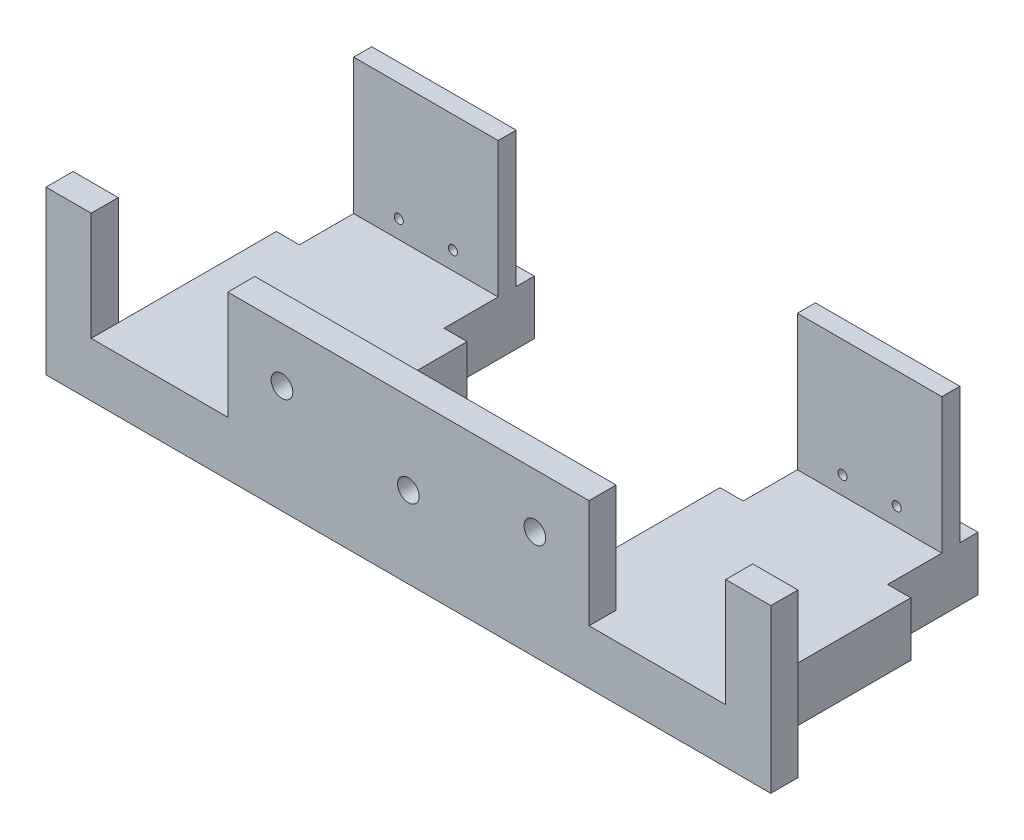
from build123d import *

# Parameters (mm, degrees)
SKETCH_1_W               = 159.79179057
SKETCH_1_H               = 74.251758256
EXTRUDE_1_DEPTH          = 20
EXTRUDE_2_DEPTH          = 20
EXTRUDE_3_DEPTH          = 10
CUT_EXTRUDE_1_DEPTH      = 531.606136663
CUT_EXTRUDE_1_DEPTH_BACK = 531.606136663
SKETCH_3_R               = 12
EXTRUDE_4_DEPTH          = 350
SKETCH_5_W               = 211.25
SKETCH_5_H               = 65
EXTRUDE_5_DEPTH          = 60
CUT_EXTRUDE_2_DEPTH      = 876.769934526
CUT_EXTRUDE_2_DEPTH_BACK = 876.769934526
SKETCH_6_W               = 160
SKETCH_6_H               = 30
SKETCH_7_R               = 25
EXTRUDE_6_DEPTH          = 185
CUT_EXTRUDE_3_DEPTH      = 676.870656298
CUT_EXTRUDE_3_DEPTH_BACK = 676.870656298
SKETCH_8_W               = 25.625
SKETCH_8_H               = 240
SKETCH_11_R              = 40
EXTRUDE_8_DEPTH          = 93.091049
EXTRUDE_9_DEPTH          = 30
EXTRUDE_10_DEPTH         = 93.091048505
EXTRUDE_11_DEPTH         = 155
SKETCH_13_W              = 644.241004896
SKETCH_13_H              = 193.771713101
CUT_EXTRUDE_5_DEPTH      = 229
CHAMFER_6_SIZE           = 40
SKETCH_15_W              = 224.735234266
SKETCH_15_H              = 137.83761035
SKETCH_15_W_2            = 260.692871749
SKETCH_15_H_2            = 187.77877352
CUT_EXTRUDE_8_DEPTH      = 406
SKETCH_16_W              = 1192.594976507
SKETCH_16_H              = 256.002705907
CUT_EXTRUDE_9_DEPTH      = 406
SKETCH_18_W              = 160
SKETCH_18_H              = 20
EXTRUDE_12_DEPTH         = 150
SKETCH_19_W              = 160
SKETCH_19_H              = 60
EXTRUDE_13_DEPTH         = 20
SKETCH_20_R              = 5
CUT_EXTRUDE_10_DEPTH     = 65


with BuildPart() as part:
    # 草图1 → 凸台-拉伸1 (new body)
    with BuildSketch(Plane.XY):
        with Locations((10.911998257, 1.128827406)):
            Rectangle(SKETCH_1_W, SKETCH_1_H)
    extrude(amount=EXTRUDE_1_DEPTH)

    # 草图2 → 凸台-拉伸2 (add)
    with BuildSketch(Plane(origin=(0, 0, 0), x_dir=(-1, 0, 0), z_dir=(0, 0, -1))):
        Polygon((309.192106458, 38.254706534), (-90.807893542, 38.254706534), (-90.807893542, -81.745293466), (-242.057893542, -81.745293466), (-242.057893542, 38.254706534), (-292.057893542, 38.254706534), (-292.057893542, -141.745293466), (510.442106458, -141.745293466), (510.442106458, 38.254706534), (460.442106458, 38.254706534), (460.442106458, -81.745293466), (309.192106458, -81.745293466), align=None)
    extrude(amount=-EXTRUDE_2_DEPTH)

    # 草图2<2> → 凸台-拉伸3 (add)
    with BuildSketch(Plane(origin=(0, 0, 0), x_dir=(-1, 0, 0), z_dir=(0, 0, -1))):
        Polygon((309.192106458, 38.254706534), (-90.807893542, 38.254706534), (-90.807893542, -81.745293466), (-242.057893542, -81.745293466), (-242.057893542, 38.254706534), (-292.057893542, 38.254706534), (-292.057893542, -141.745293466), (510.442106458, -141.745293466), (510.442106458, 38.254706534), (460.442106458, 38.254706534), (460.442106458, -81.745293466), (309.192106458, -81.745293466), align=None)
    extrude(amount=EXTRUDE_3_DEPTH)

    # 草图3 → 切除-拉伸1 (cut, two sides: drawn at the far end of the back side and taken through both)
    with BuildSketch(Plane(origin=(0, 0, -10), x_dir=(-1, 0, 0), z_dir=(0, 0, -1)).offset(-CUT_EXTRUDE_1_DEPTH_BACK)):
        with Locations((-30.807893542, -21.745293466)):
            Circle(SKETCH_3_R)
        with Locations((109.192106458, -51.745293466)):
            Circle(SKETCH_3_R)
        with Locations((249.192106458, -21.745293466)):
            Circle(SKETCH_3_R)
    extrude(amount=CUT_EXTRUDE_1_DEPTH + CUT_EXTRUDE_1_DEPTH_BACK, mode=Mode.SUBTRACT)

    # 草图4 → 凸台-拉伸4 (add)
    with BuildSketch(Plane(origin=(0, 0, -10), x_dir=(-1, 0, 0), z_dir=(0, 0, -1))):
        Polygon((460.442106458, -81.745293466), (309.192106458, -81.745293466), (249.192106458, -81.745293466), (249.192106458, -141.745293466), (309.192106458, -141.745293466), (460.442106458, -141.745293466), align=None)
        Polygon((-242.057893542, -81.745293466), (-90.807893542, -81.745293466), (-30.807893542, -81.745293466), (-30.807893542, -141.745293466), (-90.807893542, -141.745293466), (-242.057893542, -141.745293466), align=None)
    extrude(amount=EXTRUDE_4_DEPTH)

    # 草图5 → 凸台-拉伸5 (add)
    with BuildSketch(Plane.XZ.offset(141.745293466)):
        with Locations((136.432893542, -392.5)):
            Rectangle(SKETCH_5_W, SKETCH_5_H)
        with Locations((-354.817106458, -392.5)):
            Rectangle(SKETCH_5_W, SKETCH_5_H)
    extrude(amount=-EXTRUDE_5_DEPTH)

    # 草图6 → 切除-拉伸2 (cut, two sides: drawn at the far end of the back side and taken through both)
    with BuildSketch(Plane(origin=(242.057893542, 0, 0), x_dir=(0, 0, -1), z_dir=(1, 0, 0)).offset(-CUT_EXTRUDE_2_DEPTH_BACK)):
        with Locations((345, -96.745293466)):
            Rectangle(SKETCH_6_W, SKETCH_6_H)
    extrude(amount=CUT_EXTRUDE_2_DEPTH + CUT_EXTRUDE_2_DEPTH_BACK, mode=Mode.SUBTRACT)

    # 草图7 → 凸台-拉伸6 (add)
    with BuildSketch(Plane.XZ.offset(141.745293466)):
        with Locations((-354.817106458, -345)):
            Circle(SKETCH_7_R)
        with Locations((136.432893542, -345)):
            Circle(SKETCH_7_R)
    extrude(amount=-EXTRUDE_6_DEPTH)

    # 草图8 → 切除-拉伸3 (cut, two sides: drawn at the far end of the back side and taken through both)
    with BuildSketch(Plane(origin=(0, -81.745293466, 0), x_dir=(1, 0, 0), z_dir=(0, 1, 0)).offset(-CUT_EXTRUDE_3_DEPTH_BACK)):
        with Locations((43.620393542, 305)):
            Rectangle(SKETCH_8_W, SKETCH_8_H)
        Polygon((-434.817106458, 425), (-434.817106458, 265), (-434.817106458, 185), (-460.442106458, 185), (-460.442106458, 516.096231242), (-434.817106458, 516.096231242), align=None)
        Polygon((-274.817106458, 425), (-274.817106458, 265), (-274.817106458, 185), (-219.643944132, 185), (-219.643944132, 516.096231242), (-274.817106458, 516.096231242), align=None)
        with Locations((229.245393542, 305)):
            Rectangle(SKETCH_8_W, SKETCH_8_H)
    extrude(amount=CUT_EXTRUDE_3_DEPTH + CUT_EXTRUDE_3_DEPTH_BACK, mode=Mode.SUBTRACT)

    # 草图11 → 凸台-拉伸8 (add)
    with BuildSketch(Plane(origin=(0, -111.745293466, 0), x_dir=(1, 0, 0), z_dir=(0, 1, 0))):
        with Locations(Location((-354.817106458, 345, 0), (0, 0, 90))):
            Circle(SKETCH_11_R)
        with Locations(Location((136.432893542, 345, 0), (0, 0, 90))):
            Circle(SKETCH_11_R)
    extrude(amount=EXTRUDE_8_DEPTH)

    # 草图12 → 凸台-拉伸9 (add)
    with BuildSketch(Plane(origin=(0, -111.745293466, 0), x_dir=(1, 0, 0), z_dir=(0, 1, 0))):
        with BuildLine():
            ThreePointArc((-569.817106458, 345), (-529.817106458, 385), (-489.817106458, 345))
            Line((-489.817106458, 345), (-434.817106458, 345))
            Line((-434.817106458, 345), (-434.817106458, 425))
            Line((-434.817106458, 425), (-569.817106458, 425))
            Line((-569.817106458, 425), (-609.817106458, 385))
            Line((-609.817106458, 385), (-609.817106458, 345))
            Line((-609.817106458, 345), (-569.817106458, 345))
        make_face()
        with BuildLine():
            ThreePointArc((-569.817106458, 345), (-529.817106458, 305), (-489.817106458, 345))
            Line((-489.817106458, 345), (-504.817106458, 345))
            ThreePointArc((-504.817106458, 345), (-529.817106458, 320), (-554.817106458, 345))
            Line((-554.817106458, 345), (-569.817106458, 345))
        make_face()
        with BuildLine():
            Line((-504.817106458, 345), (-489.817106458, 345))
            ThreePointArc((-489.817106458, 345), (-529.817106458, 385), (-569.817106458, 345))
            Line((-569.817106458, 345), (-554.817106458, 345))
            ThreePointArc((-554.817106458, 345), (-529.817106458, 370), (-504.817106458, 345))
        make_face()
        with BuildLine():
            ThreePointArc((-554.817106458, 345), (-529.817106458, 320), (-504.817106458, 345))
            Line((-504.817106458, 345), (-554.817106458, 345))
        make_face()
        with BuildLine():
            Line((-554.817106458, 345), (-504.817106458, 345))
            ThreePointArc((-504.817106458, 345), (-529.817106458, 370), (-554.817106458, 345))
        make_face()
        with BuildLine():
            Line((-434.817106458, 345), (-489.817106458, 345))
            ThreePointArc((-489.817106458, 345), (-529.817106458, 305), (-569.817106458, 345))
            Line((-569.817106458, 345), (-609.817106458, 345))
            Line((-609.817106458, 345), (-609.817106458, 305))
            Line((-609.817106458, 305), (-569.817106458, 265))
            Line((-569.817106458, 265), (-434.817106458, 265))
            Line((-434.817106458, 265), (-434.817106458, 345))
        make_face()
    extrude_9 = extrude(amount=-EXTRUDE_9_DEPTH)

    # 草图12<3> → 凸台-拉伸10 (add)
    with BuildSketch(Plane(origin=(0, -111.745293466, 0), x_dir=(1, 0, 0), z_dir=(0, 1, 0))):
        with BuildLine():
            ThreePointArc((-569.817106458, 345), (-529.817106458, 305), (-489.817106458, 345))
            Line((-489.817106458, 345), (-504.817106458, 345))
            ThreePointArc((-504.817106458, 345), (-529.817106458, 320), (-554.817106458, 345))
            Line((-554.817106458, 345), (-569.817106458, 345))
        make_face()
        with BuildLine():
            Line((-504.817106458, 345), (-489.817106458, 345))
            ThreePointArc((-489.817106458, 345), (-529.817106458, 385), (-569.817106458, 345))
            Line((-569.817106458, 345), (-554.817106458, 345))
            ThreePointArc((-554.817106458, 345), (-529.817106458, 370), (-504.817106458, 345))
        make_face()
        with BuildLine():
            ThreePointArc((-554.817106458, 345), (-529.817106458, 320), (-504.817106458, 345))
            Line((-504.817106458, 345), (-554.817106458, 345))
        make_face()
        with BuildLine():
            Line((-554.817106458, 345), (-504.817106458, 345))
            ThreePointArc((-504.817106458, 345), (-529.817106458, 370), (-554.817106458, 345))
        make_face()
    extrude_10 = extrude(amount=EXTRUDE_10_DEPTH)

    # 草图12<4> → 凸台-拉伸11 (add)
    with BuildSketch(Plane(origin=(0, -111.745293466, 0), x_dir=(1, 0, 0), z_dir=(0, 1, 0))):
        with BuildLine():
            ThreePointArc((-554.817106458, 345), (-529.817106458, 320), (-504.817106458, 345))
            Line((-504.817106458, 345), (-554.817106458, 345))
        make_face()
        with BuildLine():
            Line((-554.817106458, 345), (-504.817106458, 345))
            ThreePointArc((-504.817106458, 345), (-529.817106458, 370), (-554.817106458, 345))
        make_face()
    extrude_11 = extrude(amount=EXTRUDE_11_DEPTH)

    # 镜向1: 凸台-拉伸9, 凸台-拉伸10, 凸台-拉伸11 across plane
    add(extrude_9.mirror(Plane(origin=(-109.192106458, 0, 0), x_dir=(0, 0, 1), z_dir=(1, 0, 0))))
    add(extrude_10.mirror(Plane(origin=(-109.192106458, 0, 0), x_dir=(0, 0, 1), z_dir=(1, 0, 0))))
    add(extrude_11.mirror(Plane(origin=(-109.192106458, 0, 0), x_dir=(0, 0, 1), z_dir=(1, 0, 0))))

    # 草图13 → 切除-拉伸5 (cut)
    with BuildSketch(Plane(origin=(0, -111.745293466, 0), x_dir=(1, 0, 0), z_dir=(0, 1, 0))):
        with Locations((-118.68092746, 369.802896621)):
            Rectangle(SKETCH_13_W, SKETCH_13_H)
    extrude(amount=CUT_EXTRUDE_5_DEPTH, mode=Mode.SUBTRACT)

    # 倒角6
    chamfer_6_edges = [part.edges().sort_by_distance(p)[0] for p in [
        (-274.817106458, -126.745293466, -425),
        (56.432893542, -126.745293466, -425),
    ]]
    chamfer(chamfer_6_edges, length=CHAMFER_6_SIZE)

    # 草图15 → 切除-拉伸8 (cut)
    with BuildSketch(Plane(origin=(0, -111.745293466, 0), x_dir=(1, 0, 0), z_dir=(0, 1, 0))):
        with Locations((-507.223176925, 357.81701746)):
            Rectangle(SKETCH_15_W, SKETCH_15_H)
        with Locations((316.806015386, 361.812310513)):
            Rectangle(SKETCH_15_W_2, SKETCH_15_H_2)
    extrude(amount=CUT_EXTRUDE_8_DEPTH, mode=Mode.SUBTRACT)

    # 草图16 → 切除-拉伸9 (cut)
    with BuildSketch(Plane(origin=(0, -111.745293466, 0), x_dir=(1, 0, 0), z_dir=(0, 1, 0))):
        with Locations((-128.169748462, 393.001352954)):
            Rectangle(SKETCH_16_W, SKETCH_16_H)
    extrude(amount=-CUT_EXTRUDE_9_DEPTH, mode=Mode.SUBTRACT)

    # 草图18 → 凸台-拉伸12 (add)
    with BuildSketch(Plane(origin=(0, -81.745293466, 0), x_dir=(1, 0, 0), z_dir=(0, 1, 0))):
        with Locations((-354.817106458, 255)):
            Rectangle(SKETCH_18_W, SKETCH_18_H)
    extrude_12 = extrude(amount=EXTRUDE_12_DEPTH)

    # 镜向2: 凸台-拉伸12 across plane
    add(extrude_12.mirror(Plane(origin=(-109.192106458, 0, 0), x_dir=(0, 0, 1), z_dir=(1, 0, 0))))

    # 草图19 → 凸台-拉伸13 (add)
    with BuildSketch(Plane(origin=(0, 0, -265), x_dir=(-1, 0, 0), z_dir=(0, 0, -1))):
        with Locations((354.817106458, -111.745293466)):
            Rectangle(SKETCH_19_W, SKETCH_19_H)
        with Locations((-136.432893542, -111.745293466)):
            Rectangle(SKETCH_19_W, SKETCH_19_H)
    extrude(amount=EXTRUDE_13_DEPTH)

    # 草图20 → 切除-拉伸10 (cut)
    with BuildSketch(Plane(origin=(0, 0, -285), x_dir=(-1, 0, 0), z_dir=(0, 0, -1))):
        with Locations((384.817106458, -61.745293466)):
            Circle(SKETCH_20_R)
        with Locations((324.817106458, -61.745293466)):
            Circle(SKETCH_20_R)
        with Locations(Location((-106.432893542, -61.745293466, 0), (0, 0, 180))):
            Circle(SKETCH_20_R)
        with Locations(Location((-166.432893542, -61.745293466, 0), (0, 0, 180))):
            Circle(SKETCH_20_R)
    extrude(amount=-CUT_EXTRUDE_10_DEPTH, mode=Mode.SUBTRACT)


solid = part.part
